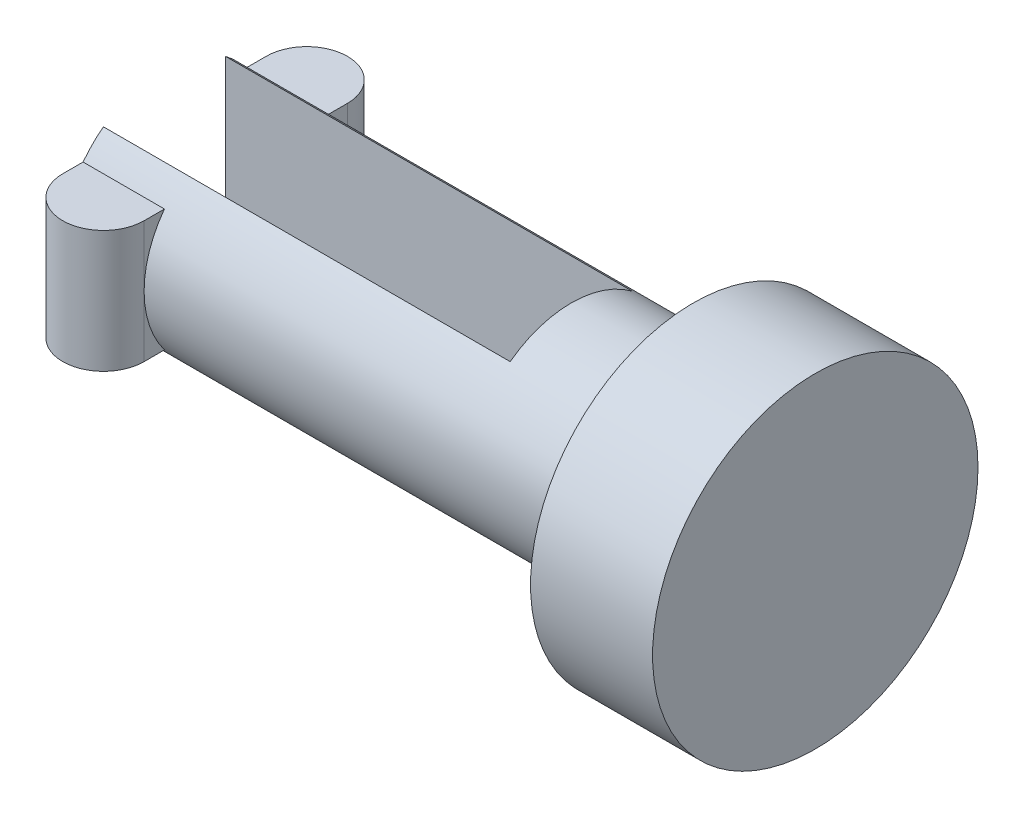
from build123d import *

# Parameters (mm, degrees)
SKETCH1_R               = 4
BOSS_EXTRUDE1_DEPTH     = 3
SKETCH1_3_R             = 2.5
BOSS_EXTRUDE2_DEPTH     = 13
BOSS_EXTRUDE3_DEPTH     = 1.5
CUT_EXTRUDE1_DEPTH      = 15.177446879
CUT_EXTRUDE1_DEPTH_BACK = 15.177446879
SKETCH2_W               = 10
SKETCH2_H               = 3


with BuildPart() as part:
    # Sketch1 → Boss-Extrude1 (new body)
    with BuildSketch(Plane(origin=(0, 0, 0), x_dir=(0, 0, -1), z_dir=(1, 0, 0))):
        Circle(SKETCH1_R)
    extrude(amount=BOSS_EXTRUDE1_DEPTH)

    # Sketch1<3> → Boss-Extrude2 (add)
    with BuildSketch(Plane(origin=(0, 0, 0), x_dir=(0, 0, -1), z_dir=(1, 0, 0))):
        Circle(SKETCH1_3_R)
    extrude(amount=-BOSS_EXTRUDE2_DEPTH)

    # Sketch3 → Boss-Extrude3 (add, symmetric)
    with BuildSketch(Plane(origin=(0, 0, 0), x_dir=(1, 0, 0), z_dir=(0, 1, 0))):
        with BuildLine():
            Line((-11, 2.5), (-11, -2.5))
            ThreePointArc((-11, -2.5), (-12, -3.5), (-13, -2.5))
            Line((-13, -2.5), (-13, 2.5))
            ThreePointArc((-13, 2.5), (-12, 3.5), (-11, 2.5))
        make_face()
    extrude(amount=BOSS_EXTRUDE3_DEPTH, both=True)

    # Sketch2 → Cut-Extrude1 (cut, two sides: drawn at the far end of the back side and taken through both)
    with BuildSketch(Plane(origin=(0, 0, 0), x_dir=(1, 0, 0), z_dir=(0, 1, 0)).offset(-CUT_EXTRUDE1_DEPTH_BACK)):
        with Locations((-8, 0)):
            Rectangle(SKETCH2_W, SKETCH2_H)
    extrude(amount=CUT_EXTRUDE1_DEPTH + CUT_EXTRUDE1_DEPTH_BACK, mode=Mode.SUBTRACT)


solid = part.part
